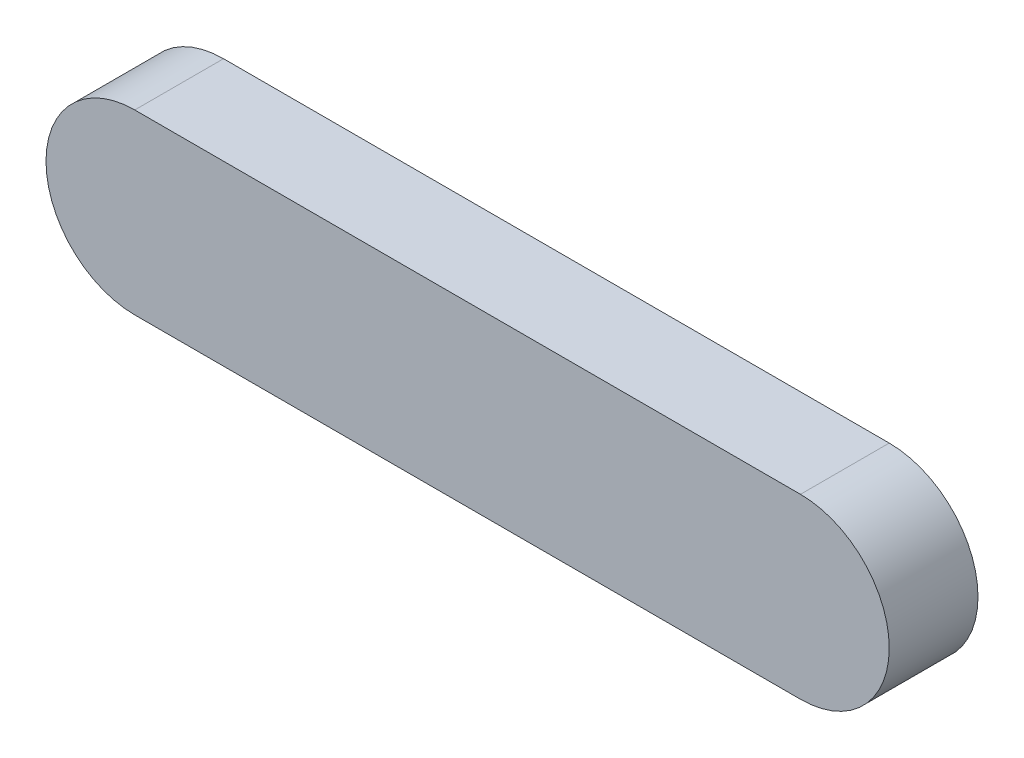
from build123d import *

# Parameters (mm, degrees)
EXTRUDE_1_DEPTH = 20


with BuildPart() as part:
    # 草图1 → 凸台-拉伸1 (new body)
    with BuildSketch(Plane.XY):
        with BuildLine():
            Line((-75, 20), (75, 20))
            ThreePointArc((75, 20), (95, 0), (75, -20))
            Line((75, -20), (-75, -20))
            ThreePointArc((-75, -20), (-95, 0), (-75, 20))
        make_face()
    extrude(amount=EXTRUDE_1_DEPTH)


solid = part.part
